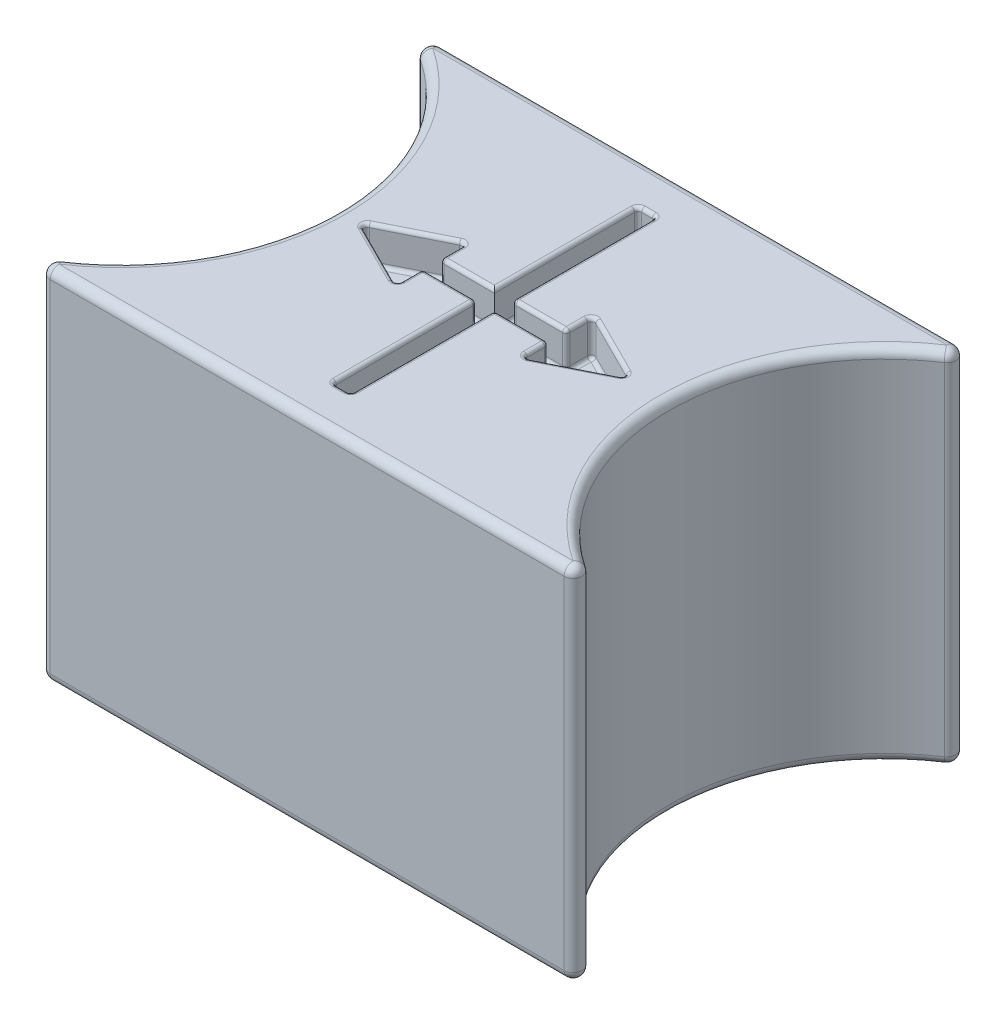
from build123d import *

# Parameters (mm, degrees)
SKETCH1_W           = 16.2196532
SKETCH1_H           = 10.9017341
BOSS_EXTRUDE1_DEPTH = 10
SKETCH2_R           = 6
CUT_EXTRUDE1_DEPTH  = 10
FILLET1_R           = 0.25
SKETCH3_R           = 2.5
CUT_EXTRUDE2_DEPTH  = 8
FILLET2_R           = 2
CUT_EXTRUDE3_DEPTH  = 1
FILLET3_R           = 0.1


with BuildPart() as part:
    # Sketch1 → Boss-Extrude1 (new body)
    with BuildSketch(Plane(origin=(0, 0, 0), x_dir=(1, 0, 0), z_dir=(0, 1, 0))):
        with Locations((-8.1098266, -5.45086705)):
            Rectangle(SKETCH1_W, SKETCH1_H)
    extrude(amount=BOSS_EXTRUDE1_DEPTH)

    # Sketch2 → Cut-Extrude1 (cut)
    with BuildSketch(Plane(origin=(0, 10, 0), x_dir=(1, 0, 0), z_dir=(0, 1, 0))):
        with Locations((-18.727251334, -5.45086705)):
            Circle(SKETCH2_R)
        with Locations((2.507251334, -5.45086705)):
            Circle(SKETCH2_R)
    extrude(amount=-CUT_EXTRUDE1_DEPTH, mode=Mode.SUBTRACT)

    # Fillet1
    fillet1_edges = [part.edges().sort_by_distance(p)[0] for p in [
        (-8.11, 0, 0),
        (-8.11, 10, 0),
        (-12.727251334, 10, 5.45086705),
        (-12.727251334, 0, 5.45086705),
        (-3.492748666, 10, 5.45086705),
        (-3.492748666, 0, 5.45086705),
        (-0.0003468, 5, 10.9017341),
        (-0.0003468, 5, 0),
        (-8.11, 0, 10.9017341),
        (-16.2196532, 5, 0),
        (-16.2196532, 5, 10.9017341),
        (-8.11, 10, 10.9017341),
    ]]
    fillet(fillet1_edges, radius=FILLET1_R)

    # Sketch3 → Cut-Extrude2 (cut)
    with BuildSketch(Plane.XZ):
        with Locations(Location((-8.11, 5.45, 0), (0, 0, 270))):
            Circle(SKETCH3_R)
    extrude(amount=-CUT_EXTRUDE2_DEPTH, mode=Mode.SUBTRACT)

    # Fillet2
    fillet2_edges = [part.edges().sort_by_distance(p)[0] for p in [
        (-8.11, 8, 7.95),
    ]]
    fillet(fillet2_edges, radius=FILLET2_R)

    # Sketch4 → Cut-Extrude3 (cut)
    with BuildSketch(Plane(origin=(0, 10, 0), x_dir=(1, 0, 0), z_dir=(0, 1, 0))):
        Polygon((-8.1, -5.7), (-6.6, -5.7), (-6.6, -6.45), (-4.6, -5.45), (-6.6, -4.45), (-6.6, -5.2), (-8.1, -5.2), (-8.1, -1.2), (-8.6, -1.2), (-8.6, -5.2), (-10.1, -5.2), (-10.1, -4.45), (-12.1, -5.45), (-10.1, -6.45), (-10.1, -5.7), (-8.6, -5.7), (-8.6, -9.7), (-8.1, -9.7), align=None)
    extrude(amount=-CUT_EXTRUDE3_DEPTH, mode=Mode.SUBTRACT)

    # Fillet3
    fillet3_edges = [part.edges().sort_by_distance(p)[0] for p in [
        (-8.6, 9, 3.2),
        (-8.35, 9, 1.2),
        (-8.6, 9.5, 1.2),
        (-8.1, 9, 3.2),
        (-8.1, 9.5, 1.2),
        (-7.35, 9, 5.2),
        (-8.1, 9.5, 5.2),
        (-6.6, 9, 4.825),
        (-6.6, 9.5, 5.2),
        (-5.6, 9, 4.95),
        (-6.6, 9.5, 4.45),
        (-5.6, 9, 5.95),
        (-4.6, 9.5, 5.45),
        (-6.6, 9, 6.075),
        (-6.6, 9.5, 6.45),
        (-7.35, 9, 5.7),
        (-6.6, 9.5, 5.7),
        (-8.1, 9, 7.7),
        (-8.1, 9.5, 5.7),
        (-8.35, 9, 9.7),
        (-8.1, 9.5, 9.7),
        (-8.6, 9, 7.7),
        (-8.6, 9.5, 9.7),
        (-9.35, 9, 5.7),
        (-8.6, 9.5, 5.7),
        (-10.1, 9, 6.075),
        (-10.1, 9.5, 5.7),
        (-11.1, 9, 5.95),
        (-10.1, 9.5, 6.45),
        (-11.1, 9, 4.95),
        (-12.1, 9.5, 5.45),
        (-10.1, 9, 4.825),
        (-10.1, 9.5, 4.45),
        (-9.35, 9, 5.2),
        (-10.1, 9.5, 5.2),
        (-8.6, 10, 3.2),
        (-9.35, 10, 5.2),
        (-10.1, 10, 4.825),
        (-11.1, 10, 4.95),
        (-11.1, 10, 5.95),
        (-10.1, 10, 6.075),
        (-9.35, 10, 5.7),
        (-8.6, 10, 7.7),
        (-8.35, 10, 9.7),
        (-8.1, 10, 7.7),
        (-7.35, 10, 5.7),
        (-6.6, 10, 6.075),
        (-5.6, 10, 5.95),
        (-5.6, 10, 4.95),
        (-6.6, 10, 4.825),
        (-7.35, 10, 5.2),
        (-8.1, 10, 3.2),
        (-8.35, 10, 1.2),
    ]]
    fillet(fillet3_edges, radius=FILLET3_R)


solid = part.part
